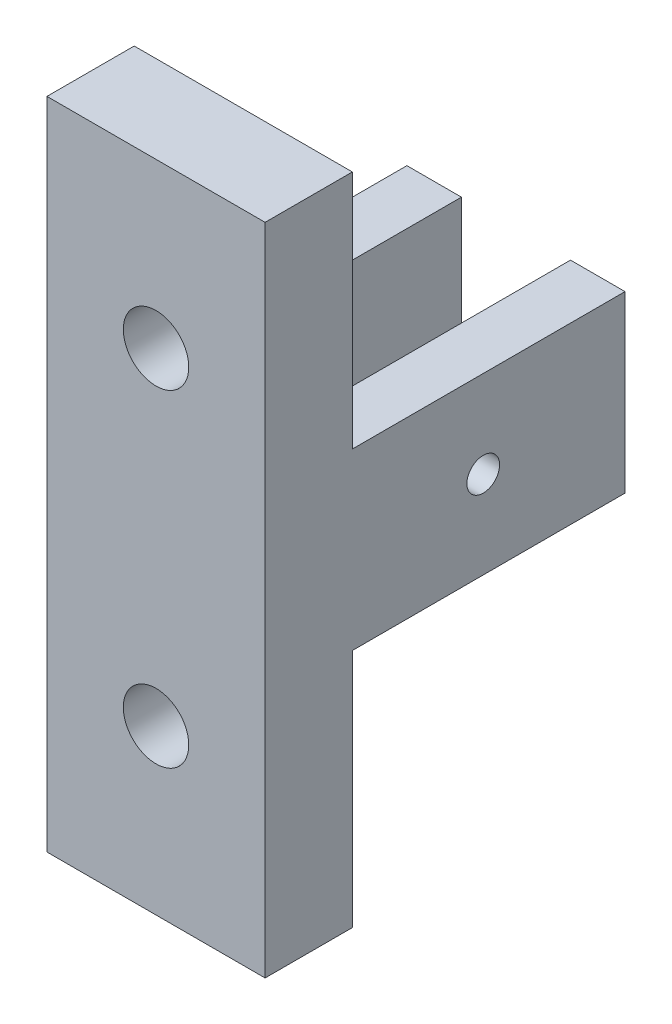
from build123d import *

# Parameters (mm, degrees)
SKETCH_1_W          = 20
SKETCH_1_H          = 60
SKETCH_1_R          = 3
EXTRUDE_1_DEPTH     = 8
EXTRUDE_3_DEPTH     = 25
SKETCH_4_R          = 1.5
CUT_EXTRUDE_1_DEPTH = 25


with BuildPart() as part:
    # 草图1 → 凸台-拉伸1 (new body)
    with BuildSketch(Plane.XY):
        Rectangle(SKETCH_1_W, SKETCH_1_H)
        with Locations((0, 15)):
            Circle(SKETCH_1_R, mode=Mode.SUBTRACT)
        with Locations((0, -15)):
            Circle(SKETCH_1_R, mode=Mode.SUBTRACT)
    extrude(amount=EXTRUDE_1_DEPTH)

    # 草图3 → 凸台-拉伸3 (add)
    with BuildSketch(Plane(origin=(0, 0, 0), x_dir=(-1, 0, 0), z_dir=(0, 0, -1))):
        Polygon((-5, -6), (-5, -8), (-10, -8), (-10, 8), (-5, 8), (-5, 6), align=None)
        Polygon((10, -8), (10, 8), (5, 8), (5, 6), (5, -6), (5, -8), align=None)
    extrude(amount=EXTRUDE_3_DEPTH)

    # 草图4 → 切除-拉伸1 (cut)
    with BuildSketch(Plane(origin=(10, 0, 0), x_dir=(0, 0, -1), z_dir=(1, 0, 0))):
        with Locations((12, 0)):
            Circle(SKETCH_4_R)
    extrude(amount=-CUT_EXTRUDE_1_DEPTH, mode=Mode.SUBTRACT)


solid = part.part
